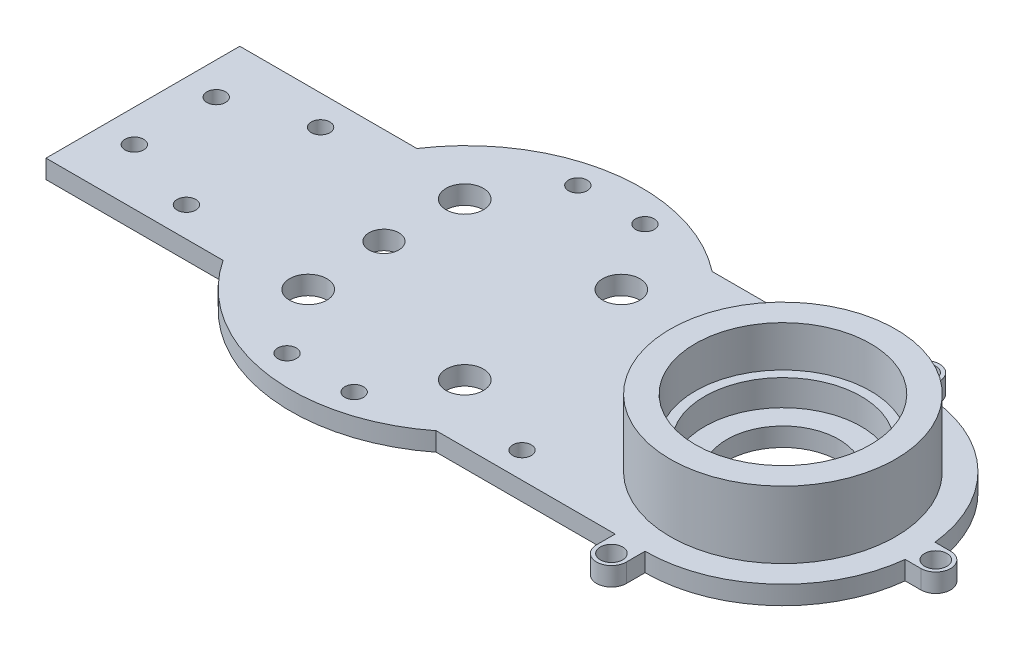
from build123d import *

# Parameters (mm, degrees)
SKETCH1_R           = 5
SKETCH1_R_2         = 5.003763765
SKETCH1_R_3         = 4.999224106
SKETCH1_R_4         = 4
SKETCH1_R_5         = 2.510575716
SKETCH1_R_6         = 2.5
SKETCH1_R_7         = 3
SKETCH1_R_8         = 3.000476209
BOSS_EXTRUDE2_DEPTH = 5
SKETCH2_R           = 15
CUT_EXTRUDE1_DEPTH  = 7
SKETCH3_R           = 23.5
SKETCH3_R_2         = 21
BOSS_EXTRUDE4_DEPTH = 7
SKETCH4_R           = 30.235
SKETCH4_R_2         = 23.5
BOSS_EXTRUDE5_DEPTH = 18


with BuildPart() as part:
    # Sketch1 → Boss-Extrude2 (new body)
    # profile 1 of 4: a face of its own
    with BuildSketch(Plane(origin=(0, 0, 0), x_dir=(1, 0, 0), z_dir=(0, 1, 0))):
        with BuildLine():
            ThreePointArc((98.745189573, 22.608483412), (135.745189573, -14.391516588), (98.745189573, -51.391516588))
            Line((98.745189573, -51.391516588), (42.750189573, -51.391516588))
            ThreePointArc((42.750189573, -51.391516588), (6.260402135, -60.813200818), (-25.419810427, -40.401516588))
            Line((-25.419810427, -40.401516588), (-72.919810427, -40.401516588))
            Line((-72.919810427, -40.401516588), (-72.919810427, 11.578483412))
            Line((-72.919810427, 11.578483412), (-25.419810427, 11.578483412))
            ThreePointArc((-25.419810427, 11.578483412), (6.249075219, 32.009532595), (42.745189573, 22.608483412))
            Line((42.745189573, 22.608483412), (98.745189573, 22.608483412))
        make_face()
        with Locations(Location((34.750094787, -35.73, 0), (0, 0, 270))):
            Circle(SKETCH1_R, mode=Mode.SUBTRACT)
        with Locations(Location((-7.249905213, -35.74, 0), (0, 0, 270))):
            Circle(SKETCH1_R_2, mode=Mode.SUBTRACT)
        with Locations(Location((34.750094787, 6.25, 0), (0, 0, 270))):
            Circle(SKETCH1_R_3, mode=Mode.SUBTRACT)
        with Locations(Location((-7.25, 6.25, 0), (0, 0, 270))):
            Circle(SKETCH1_R, mode=Mode.SUBTRACT)
        with Locations(Location((-8.259097292, -14.412316007, 0), (0, 0, 270))):
            Circle(SKETCH1_R_4, mode=Mode.SUBTRACT)
        with Locations(Location((58.780189573, 15.578483412, 0), (0, 0, 270))):
            Circle(SKETCH1_R_5, mode=Mode.SUBTRACT)
        with Locations(Location((58.780189573, -44.401516588, 0), (0, 0, 270))):
            Circle(SKETCH1_R_6, mode=Mode.SUBTRACT)
        with Locations(Location((22.750189573, -53.411516588, 0), (0, 0, 270))):
            Circle(SKETCH1_R_6, mode=Mode.SUBTRACT)
        with Locations(Location((4.750189573, -53.411516588, 0), (0, 0, 270))):
            Circle(SKETCH1_R_6, mode=Mode.SUBTRACT)
        with Locations(Location((22.750189573, 24.588483412, 0), (0, 0, 270))):
            Circle(SKETCH1_R_6, mode=Mode.SUBTRACT)
        with Locations(Location((4.750189573, 24.588483412, 0), (0, 0, 270))):
            Circle(SKETCH1_R_6, mode=Mode.SUBTRACT)
        with Locations(Location((-43.249810427, 3.588483412, 0), (0, 0, 270))):
            Circle(SKETCH1_R_6, mode=Mode.SUBTRACT)
        with Locations(Location((-43.249810427, -32.411516588, 0), (0, 0, 270))):
            Circle(SKETCH1_R_6, mode=Mode.SUBTRACT)
        with Locations(Location((-64.219810427, -25.408584333, 0), (0, 0, 270))):
            Circle(SKETCH1_R_6, mode=Mode.SUBTRACT)
        with Locations(Location((-64.25, -3.408584333, 0), (0, 0, 270))):
            Circle(SKETCH1_R_6, mode=Mode.SUBTRACT)
    # profile 2 of 4: a face of its own
    with BuildSketch(Plane(origin=(0, 0, 0), x_dir=(1, 0, 0), z_dir=(0, 1, 0))):
        with BuildLine():
            Line((98.745189573, -51.391516588), (90.745189573, -51.391516588))
            Line((90.745189573, -51.391516588), (90.745189573, -56.389870622))
            ThreePointArc((90.745189573, -56.389870622), (94.745189573, -60.389870622), (98.745189573, -56.389870622))
            Line((98.745189573, -56.389870622), (98.745189573, -51.391516588))
        make_face()
        with Locations(Location((94.745189573, -56.389870622, 0), (0, 0, 270))):
            Circle(SKETCH1_R_7, mode=Mode.SUBTRACT)
    # profile 3 of 4: a face of its own
    with BuildSketch(Plane(origin=(0, 0, 0), x_dir=(1, 0, 0), z_dir=(0, 1, 0))):
        with BuildLine():
            ThreePointArc((135.528803249, -10.395798263), (135.745189573, -14.391516588), (135.528803249, -18.387234913))
            Line((135.528803249, -18.387234913), (139.748478132, -18.387234913))
            ThreePointArc((139.748478132, -18.387234913), (143.744196457, -14.391516588), (139.748478132, -10.395798263))
            Line((139.748478132, -10.395798263), (135.528803249, -10.395798263))
        make_face()
        with Locations(Location((139.748478132, -14.391516588, 0), (0, 0, 270))):
            Circle(SKETCH1_R_8, mode=Mode.SUBTRACT)
    # profile 4 of 4: a face of its own
    with BuildSketch(Plane(origin=(0, 0, 0), x_dir=(1, 0, 0), z_dir=(0, 1, 0))):
        with BuildLine():
            Line((90.745189573, 27.608483412), (90.745189573, 22.608483412))
            Line((90.745189573, 22.608483412), (98.745189573, 22.608483412))
            Line((98.745189573, 22.608483412), (98.745189573, 27.608483412))
            ThreePointArc((98.745189573, 27.608483412), (94.745189573, 31.608483412), (90.745189573, 27.608483412))
        make_face()
        with Locations(Location((94.745189573, 27.608483412, 0), (0, 0, 270))):
            Circle(SKETCH1_R_7, mode=Mode.SUBTRACT)
    extrude(amount=BOSS_EXTRUDE2_DEPTH)

    # Sketch2 → Cut-Extrude1 (cut)
    with BuildSketch(Plane(origin=(0, 5, 0), x_dir=(1, 0, 0), z_dir=(0, 1, 0))):
        with Locations(Location((98.745189573, -14.391516588, 0), (0, 0, 270))):
            Circle(SKETCH2_R)
    extrude(amount=-CUT_EXTRUDE1_DEPTH, mode=Mode.SUBTRACT)

    # Sketch3 → Boss-Extrude4 (add)
    with BuildSketch(Plane(origin=(0, 5, 0), x_dir=(1, 0, 0), z_dir=(0, 1, 0))):
        with Locations(Location((98.745189573, -14.391516588, 0), (0, 0, 270))):
            Circle(SKETCH3_R)
        with Locations(Location((98.745189573, -14.391516588, 0), (0, 0, 270))):
            Circle(SKETCH3_R_2, mode=Mode.SUBTRACT)
    extrude(amount=BOSS_EXTRUDE4_DEPTH)

    # Sketch4 → Boss-Extrude5 (add)
    with BuildSketch(Plane(origin=(0, 5, 0), x_dir=(1, 0, 0), z_dir=(0, 1, 0))):
        with Locations(Location((98.745189573, -14.391516588, 0), (0, 0, 270))):
            Circle(SKETCH4_R)
        with Locations(Location((98.745189573, -14.391516588, 0), (0, 0, 270))):
            Circle(SKETCH4_R_2, mode=Mode.SUBTRACT)
    extrude(amount=BOSS_EXTRUDE5_DEPTH)


solid = part.part
